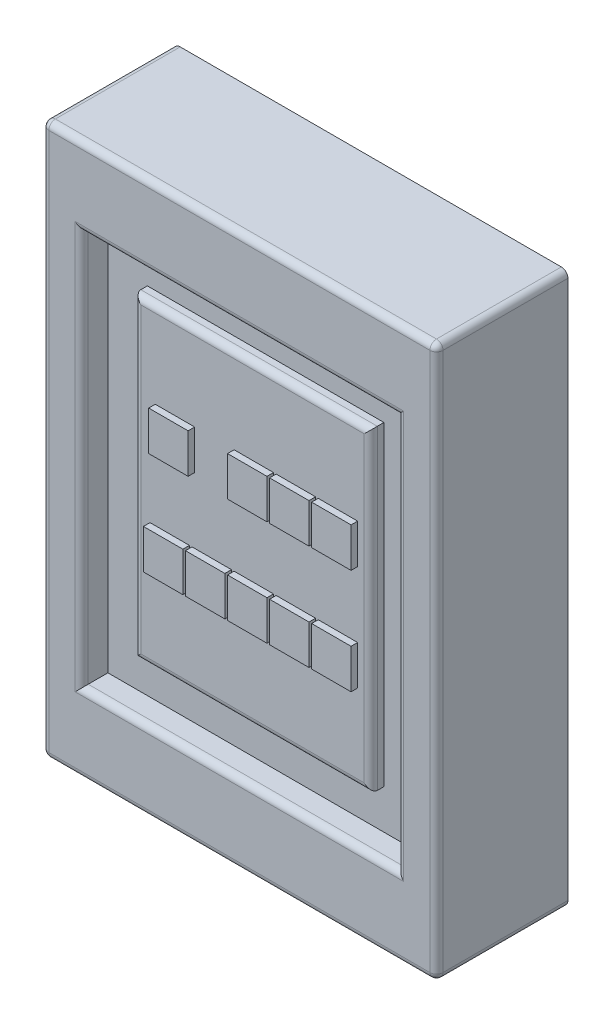
from build123d import *

# Parameters (mm, degrees)
SKETCH1_W           = 300
SKETCH1_H           = 420
BOSS_EXTRUDE1_DEPTH = 100
SKETCH2_W           = 240
SKETCH2_H           = 300
CUT_EXTRUDE1_DEPTH  = 20
SKETCH3_W           = 180
SKETCH3_H           = 240
BOSS_EXTRUDE2_DEPTH = 10
SKETCH4_W           = 30
SKETCH4_H           = 30
BOSS_EXTRUDE3_DEPTH = 5
FILLET1_R           = 5
FILLET2_R           = 5


with BuildPart() as part:
    # Sketch1 → Boss-Extrude1 (new body)
    with BuildSketch(Plane.XY):
        with Locations((150, 210)):
            Rectangle(SKETCH1_W, SKETCH1_H)
    extrude(amount=BOSS_EXTRUDE1_DEPTH)

    # Sketch2 → Cut-Extrude1 (cut)
    with BuildSketch(Plane.XY.offset(100)):
        with Locations((150, 210)):
            Rectangle(SKETCH2_W, SKETCH2_H)
    extrude(amount=-CUT_EXTRUDE1_DEPTH, mode=Mode.SUBTRACT)

    # Sketch3 → Boss-Extrude2 (add)
    with BuildSketch(Plane.XY.offset(80)):
        with Locations((150, 210)):
            Rectangle(SKETCH3_W, SKETCH3_H)
    extrude(amount=BOSS_EXTRUDE2_DEPTH)

    # Sketch4 → Boss-Extrude3 (add)
    with BuildSketch(Plane.XY.offset(90)):
        with Locations((91, 250)):
            Rectangle(SKETCH4_W, SKETCH4_H)
        with Locations((151, 250)):
            Rectangle(SKETCH4_W, SKETCH4_H)
        with Locations((183, 250)):
            Rectangle(SKETCH4_W, SKETCH4_H)
        with Locations((215, 250)):
            Rectangle(SKETCH4_W, SKETCH4_H)
        with Locations((87, 170)):
            Rectangle(SKETCH4_W, SKETCH4_H)
        with Locations((119, 170)):
            Rectangle(SKETCH4_W, SKETCH4_H)
        with Locations((151, 170)):
            Rectangle(SKETCH4_W, SKETCH4_H)
        with Locations((183, 170)):
            Rectangle(SKETCH4_W, SKETCH4_H)
        with Locations((215, 170)):
            Rectangle(SKETCH4_W, SKETCH4_H)
    extrude(amount=BOSS_EXTRUDE3_DEPTH)

    # Fillet1
    fillet1_edges = [part.edges().sort_by_distance(p)[0] for p in [
        (300, 210, 100),
        (150, 0, 100),
        (30, 210, 100),
        (150, 60, 100),
        (270, 210, 100),
        (150, 360, 100),
        (0, 210, 100),
        (150, 420, 100),
        (0, 0, 50),
        (300, 0, 50),
        (300, 420, 50),
        (0, 420, 50),
    ]]
    fillet(fillet1_edges, radius=FILLET1_R)

    # Fillet2
    fillet2_edges = [part.edges().sort_by_distance(p)[0] for p in [
        (150, 330, 90),
        (60, 210, 90),
        (150, 90, 90),
        (240, 210, 90),
    ]]
    fillet(fillet2_edges, radius=FILLET2_R)


solid = part.part
